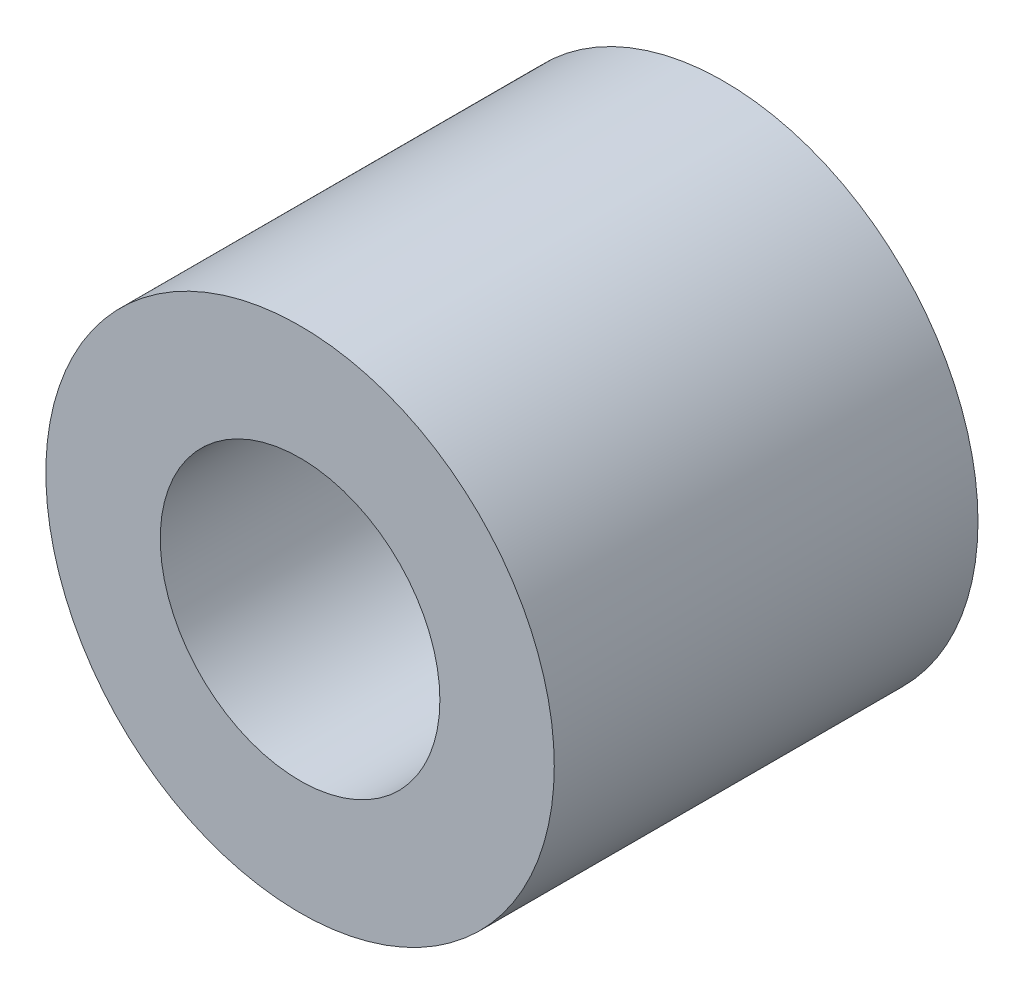
from build123d import *

# Parameters (mm, degrees)
SKETCH_1_R      = 3
SKETCH_1_R_2    = 1.65
EXTRUDE_1_DEPTH = 5


with BuildPart() as part:
    # Эскиз1 → Бобышка-Вытянуть1 (new body)
    with BuildSketch(Plane.XY):
        Circle(SKETCH_1_R)
        Circle(SKETCH_1_R_2, mode=Mode.SUBTRACT)
    extrude(amount=EXTRUDE_1_DEPTH)


solid = part.part
